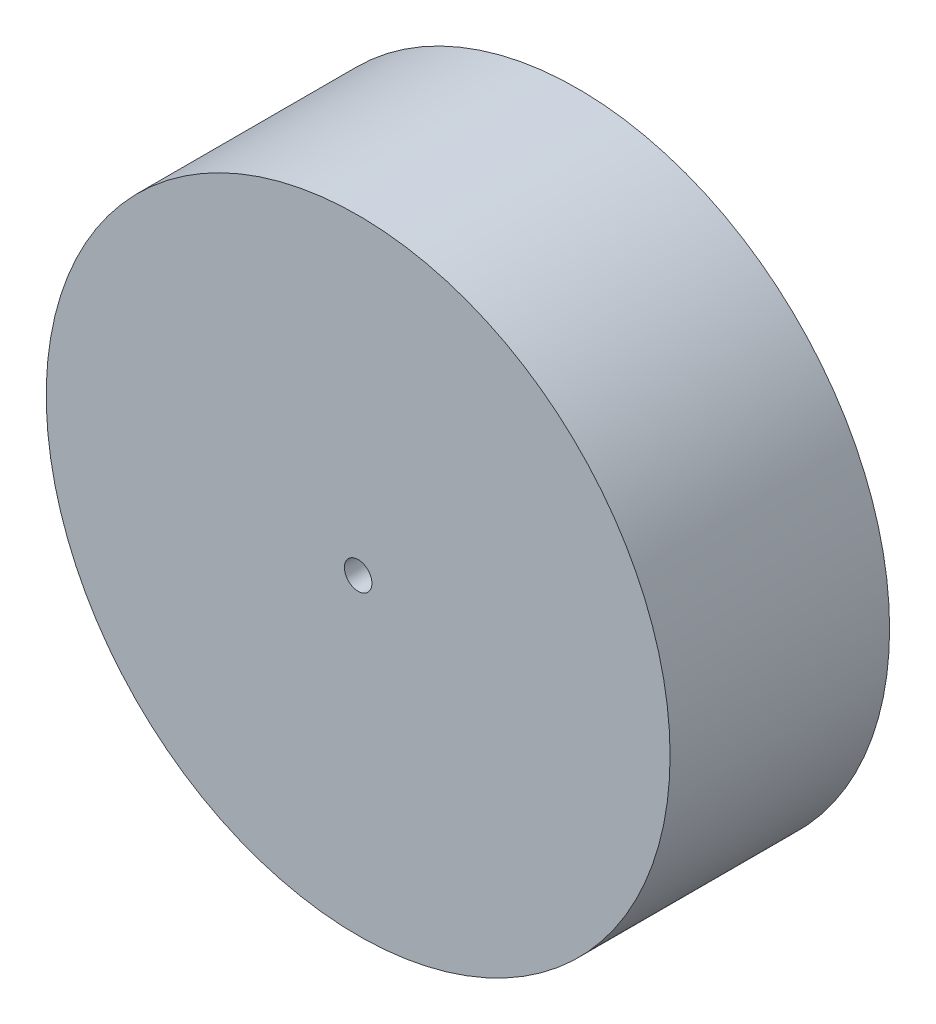
from build123d import *

# Parameters (mm, degrees)
SKETCH1_R           = 54
SKETCH1_R_2         = 2.38125
BOSS_EXTRUDE1_DEPTH = 38


with BuildPart() as part:
    # Sketch1 → Boss-Extrude1 (new body)
    with BuildSketch(Plane.XY):
        Circle(SKETCH1_R)
        Circle(SKETCH1_R_2, mode=Mode.SUBTRACT)
    extrude(amount=BOSS_EXTRUDE1_DEPTH)


solid = part.part
